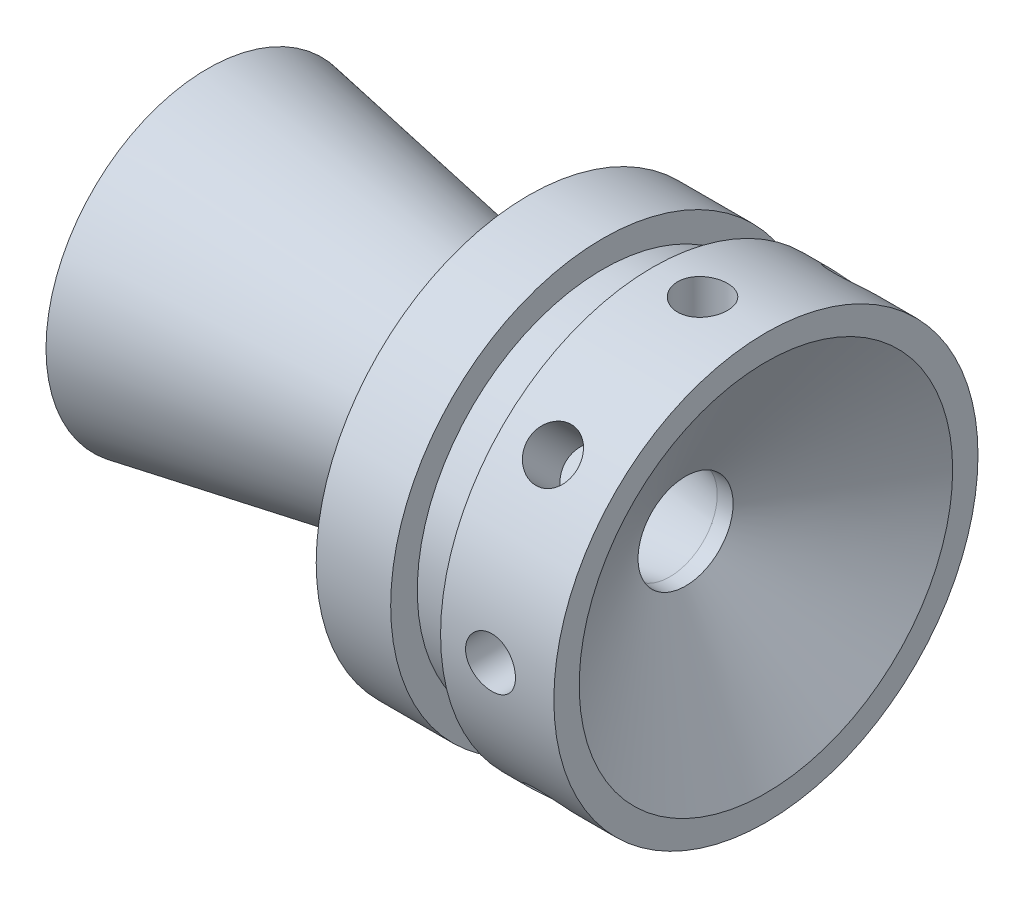
from build123d import *

# Parameters (mm, degrees)
SKETCH2_R          = 2
CUT_EXTRUDE1_DEPTH = 5.08
CIRPATTERN1_COUNT  = 8


with BuildPart() as part:
    # Sketch1 → Revolve1 (revolve)
    with BuildSketch(Plane.XY, mode=Mode.PRIVATE) as revolve1_sk:
        Polygon((0, 8.421280131), (0, 17), (5.969, 17), (5.969, 14.8664), (9.969, 14.8664), (9.969, 17), (19.05, 17), (19.05, 14.968), (12.607925696, 3.81), (11.337925696, 3.81), (-25.706331786, 11.684), (-25.706331786, 12.954), align=None)
    revolve(revolve1_sk.sketch.rotate(Axis((0, 0, 0), (-1, 0, 0)), 90), axis=Axis((0, 0, 0), (-1, 0, 0)))

    # Sketch2 → Cut-Extrude1 (cut)
    with BuildSketch(Plane.XY.offset(17.78)):
        with Locations((13.97, 0)):
            Circle(SKETCH2_R)
    cut_extrude1 = extrude(amount=-CUT_EXTRUDE1_DEPTH, mode=Mode.SUBTRACT)

    # CirPattern1: Cut-Extrude1 ×8 about axis
    cirpattern1_axis = Axis((0, 0, 0), (1, 0, 0))
    for i in range(1, CIRPATTERN1_COUNT):
        add(cut_extrude1.rotate(cirpattern1_axis, i * 360 / CIRPATTERN1_COUNT), mode=Mode.SUBTRACT)


solid = part.part
